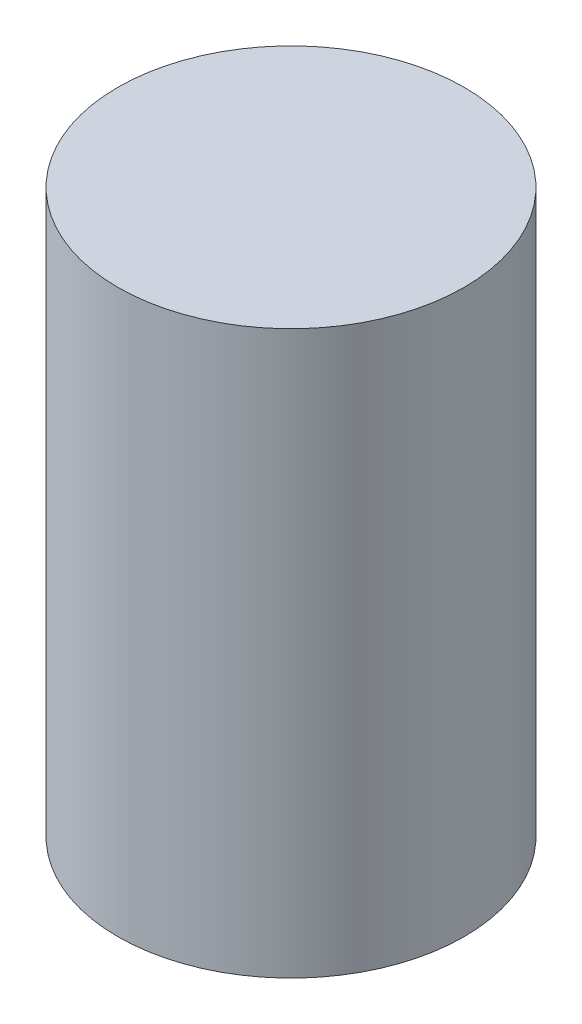
from build123d import *

# Parameters (mm, degrees)
SKETCH1_R           = 7.7
BOSS_EXTRUDE1_DEPTH = 25


with BuildPart() as part:
    # Sketch1 → Boss-Extrude1 (new body)
    with BuildSketch(Plane(origin=(0, 0, 0), x_dir=(1, 0, 0), z_dir=(0, 1, 0))):
        with Locations(Location((0, 0, 0), (0, 0, 270))):
            Circle(SKETCH1_R)
    extrude(amount=BOSS_EXTRUDE1_DEPTH)


solid = part.part
